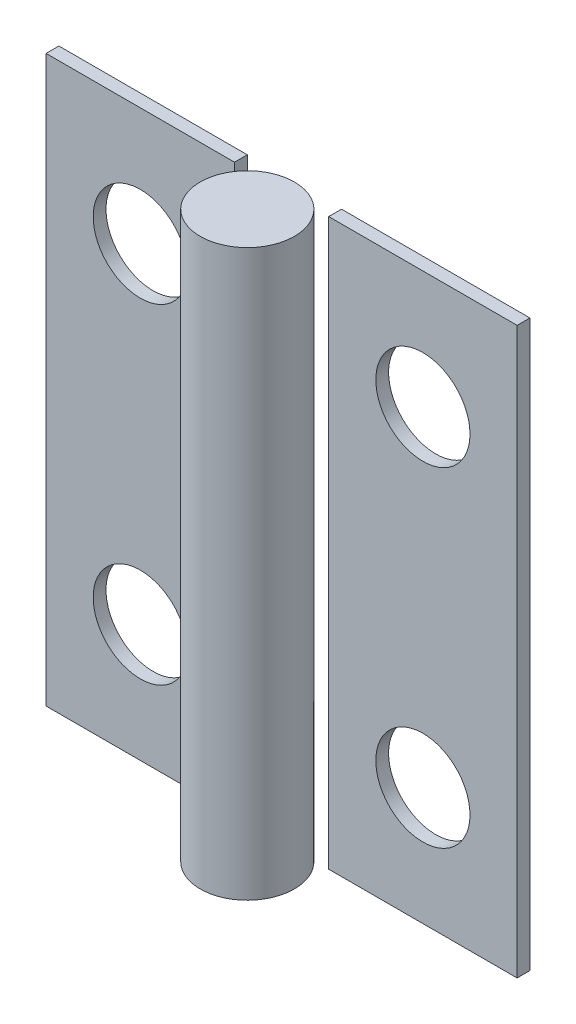
from build123d import *

# Parameters (mm, degrees)
SKETCH1_W             = 6.35
SKETCH1_H             = 19.05
SKETCH1_R             = 1.5875
BOSS_EXTRUDE1_DEPTH   = 0.4318
BOSS_EXTRUDE1_2_DEPTH = 0.4318
SKETCH2_R             = 1.5875
BOSS_EXTRUDE2_DEPTH   = 19.05


with BuildPart() as part:
    # Sketch1 → Boss-Extrude1 (new body)
    with BuildSketch(Plane.XY):
        with Locations((-4.7625, 9.525)):
            Rectangle(SKETCH1_W, SKETCH1_H)
        with Locations((-4.7625, 15.08125)):
            Circle(SKETCH1_R, mode=Mode.SUBTRACT)
        with Locations((-4.7625, 3.96875)):
            Circle(SKETCH1_R, mode=Mode.SUBTRACT)
    extrude(amount=BOSS_EXTRUDE1_DEPTH)


with BuildPart() as body_2:
    # Sketch1 → Boss-Extrude1 2 (new body)
    with BuildSketch(Plane.XY):
        with Locations((4.7625, 9.525)):
            Rectangle(SKETCH1_W, SKETCH1_H)
        with Locations((4.7625, 3.96875)):
            Circle(SKETCH1_R, mode=Mode.SUBTRACT)
        with Locations((4.7625, 15.08125)):
            Circle(SKETCH1_R, mode=Mode.SUBTRACT)
    extrude(amount=BOSS_EXTRUDE1_2_DEPTH)


with BuildPart() as body_3:
    # Sketch2 → Boss-Extrude2 (new body)
    with BuildSketch(Plane(origin=(0, 0, 0), x_dir=(1, 0, 0), z_dir=(0, 1, 0))):
        with Locations(Location((0, -1.5875, 0), (0, 0, 90))):
            Circle(SKETCH2_R)
    extrude(amount=BOSS_EXTRUDE2_DEPTH)


solid = Compound([part.part, body_2.part, body_3.part])
